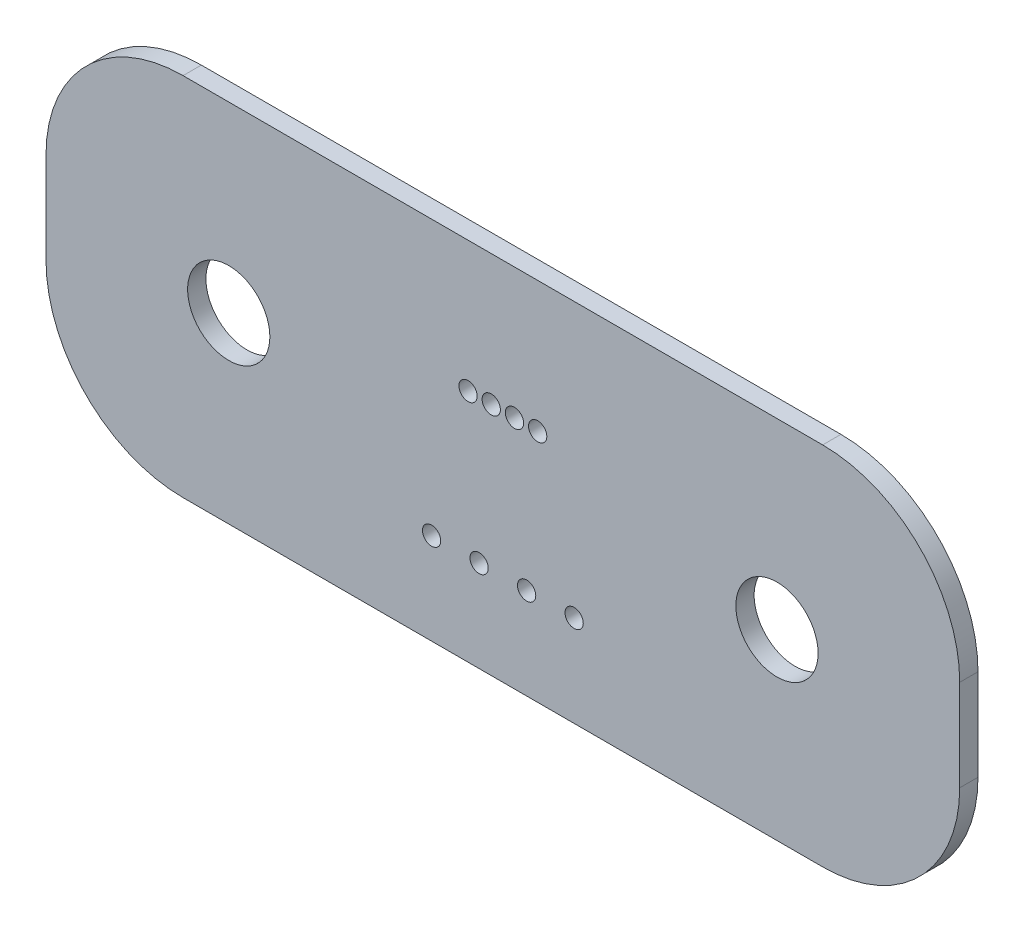
from build123d import *

# Parameters (mm, degrees)
SKETCH1_R           = 2.25
SKETCH1_R_2         = 0.5
BOSS_EXTRUDE1_DEPTH = 1


with BuildPart() as part:
    # Sketch1 → Boss-Extrude1 (new body)
    with BuildSketch(Plane.XY):
        with BuildLine():
            Line((-17.5, -5), (17.5, -5))
            ThreePointArc((17.5, -5), (22.803300859, -7.196699141), (25, -12.5))
            Line((25, -12.5), (25, -17.5))
            ThreePointArc((25, -17.5), (22.803300859, -22.803300859), (17.5, -25))
            Line((17.5, -25), (-17.5, -25))
            ThreePointArc((-17.5, -25), (-22.803300859, -22.803300859), (-25, -17.5))
            Line((-25, -17.5), (-25, -12.5))
            ThreePointArc((-25, -12.5), (-22.803300859, -7.196699141), (-17.5, -5))
        make_face()
        with Locations((15, -15)):
            Circle(SKETCH1_R, mode=Mode.SUBTRACT)
        with Locations((-15, -15)):
            Circle(SKETCH1_R, mode=Mode.SUBTRACT)
        with Locations((-1.905, -12.15)):
            Circle(SKETCH1_R_2, mode=Mode.SUBTRACT)
        with Locations((1.905, -12.15)):
            Circle(SKETCH1_R_2, mode=Mode.SUBTRACT)
        with Locations((-0.635, -12.15)):
            Circle(SKETCH1_R_2, mode=Mode.SUBTRACT)
        with Locations((0.635, -12.15)):
            Circle(SKETCH1_R_2, mode=Mode.SUBTRACT)
        with Locations((-3.9, -20)):
            Circle(SKETCH1_R_2, mode=Mode.SUBTRACT)
        with Locations((-1.3, -20)):
            Circle(SKETCH1_R_2, mode=Mode.SUBTRACT)
        with Locations((1.3, -20)):
            Circle(SKETCH1_R_2, mode=Mode.SUBTRACT)
        with Locations((3.9, -20)):
            Circle(SKETCH1_R_2, mode=Mode.SUBTRACT)
    extrude(amount=BOSS_EXTRUDE1_DEPTH)


solid = part.part
